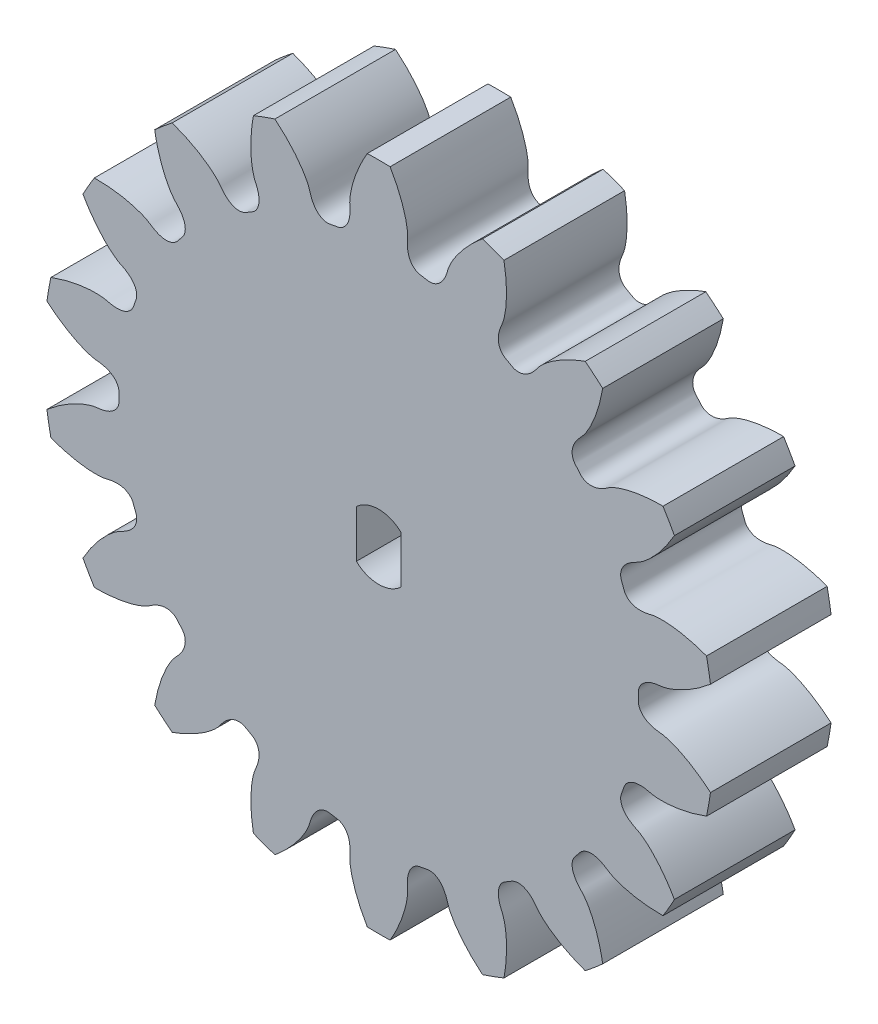
from build123d import *

# Parameters (mm, degrees)
SKETCH_311_W               = 10
SKETCH_311_H               = 27.777777778
CUT_EXTRUDE_550_DEPTH      = 9.525
PATTERN_CIRCULAR_604_COUNT = 18
CUT_EXTRUDE2_DEPTH         = 7.5


with BuildPart() as part:
    # Sketch 311 → Revolve 374 (revolve)
    with BuildSketch(Plane(origin=(0, 0, 0), x_dir=(0, 0, -1), z_dir=(1, 0, 0))):
        with Locations((0, 13.888888889)):
            Rectangle(SKETCH_311_W, SKETCH_311_H)
    revolve(axis=Axis((0, 0, 0), (0, 0, -1)))

    # Sketch 419 → Cut-Extrude 550 (cut, symmetric)
    with BuildSketch(Plane.XY):
        with BuildLine():
            ThreePointArc((27.62923006, 3.995738236), (27.916666667, 0), (27.62923006, -3.995738236))
            add(Edge.make_bspline(
                [(27.62923006, -3.995738236), (27.290831329, -3.702438459), (26.835049509, -3.341121703), (26.253328704, -2.941020847), (25.937510715, -2.738409328), (25.636143491, -2.558437255), (25.350333726, -2.399956765), (25.081128503, -2.261771509), (24.82951387, -2.142641125), (24.596412985, -2.041283545), (24.382684516, -1.956377728), (24.189121081, -1.886566916), (24.016447952, -1.830460144), (23.865321409, -1.786639488), (23.736328641, -1.753650229), (23.629983592, -1.730041219), (23.546734518, -1.714265852), (23.486941462, -1.704946935), (23.45092391, -1.700297747), (23.380025983, -1.693832885), (23.294978928, -1.687179277), (23.188735628, -1.674087341), (23.112132431, -1.663291598), (23.036959642, -1.651060808), (22.963188988, -1.637452508), (22.890796253, -1.62243551), (22.819752103, -1.605993678), (22.750024416, -1.588097373), (22.681577704, -1.568709322), (22.614373436, -1.547781188), (22.548370339, -1.525252273), (22.483524999, -1.501047302), (22.419792807, -1.475074072), (22.357129399, -1.44722073), (22.295492758, -1.417352757), (22.234846223, -1.385309698), (22.175162695, -1.350901748), (22.116430401, -1.313906457), (22.058660633, -1.274065928), (22.001897932, -1.231085154), (21.946233111, -1.184632474), (21.89181938, -1.134343527), (21.838891389, -1.079830578), (21.787786315, -1.02069952), (21.738964806, -0.956577061), (21.693028098, -0.887150157), (21.650724958, -0.812218363), (21.612942971, -0.731756292), (21.580668491, -0.645980549), (21.554941069, -0.555402644), (21.536683336, -0.460873936), (21.527650399, -0.371147884), (21.523754674, -0.217235259), (21.53096184, 0), (21.523754674, 0.217235259), (21.527650399, 0.371147884), (21.536683336, 0.460873936), (21.554941069, 0.555402644), (21.580668491, 0.645980549), (21.612942971, 0.731756292), (21.650724958, 0.812218363), (21.693028098, 0.887150157), (21.738964806, 0.956577061), (21.787786315, 1.02069952), (21.838891389, 1.079830578), (21.89181938, 1.134343527), (21.946233111, 1.184632474), (22.001897932, 1.231085154), (22.058660633, 1.274065928), (22.116430401, 1.313906457), (22.175162695, 1.350901748), (22.234846223, 1.385309698), (22.295492758, 1.417352757), (22.357129399, 1.44722073), (22.419792807, 1.475074072), (22.483524999, 1.501047302), (22.548370339, 1.525252273), (22.614373436, 1.547781188), (22.681577704, 1.568709322), (22.750024416, 1.588097373), (22.819752103, 1.605993678), (22.890796253, 1.62243551), (22.963188988, 1.637452508), (23.036959642, 1.651060808), (23.112132431, 1.663291598), (23.188735628, 1.674087341), (23.294978928, 1.687179277), (23.380025983, 1.693832885), (23.45092391, 1.700297747), (23.486941462, 1.704946935), (23.546734518, 1.714265852), (23.629983592, 1.730041219), (23.736328641, 1.753650229), (23.865321409, 1.786639488), (24.016447952, 1.830460144), (24.189121081, 1.886566916), (24.382684516, 1.956377728), (24.596412985, 2.041283545), (24.82951387, 2.142641125), (25.081128503, 2.261771509), (25.350333726, 2.399956765), (25.636143491, 2.558437255), (25.937510715, 2.738409328), (26.253328704, 2.941020847), (26.835049509, 3.341121703), (27.290831329, 3.702438459), (27.62923006, 3.995738236)],
                knots=[0, 0, 0, 0, 0.086681892, 0.112454454, 0.136665043, 0.159313658, 0.1804003, 0.199924969, 0.217887664, 0.234288386, 0.249127134, 0.262403909, 0.274118711, 0.284271539, 0.292862394, 0.299891276, 0.305358185, 0.30926312, 0.311606084, 0.312387082, 0.323045666, 0.328117752, 0.333108821, 0.33802219, 0.342861525, 0.34763088, 0.352334746, 0.356978107, 0.3615665, 0.366106083, 0.370603711, 0.375067019, 0.379504513, 0.383925662, 0.388341001, 0.39276222, 0.397202256, 0.401675347, 0.406197062, 0.410784251, 0.415454908, 0.420227881, 0.425122382, 0.430157244, 0.435349849, 0.44071472, 0.446261769, 0.451994334, 0.45790724, 0.46398525, 0.470202375, 0.476522482, 0.481418853, 0.5, 0.518581147, 0.523477518, 0.529797625, 0.53601475, 0.54209276, 0.548005666, 0.553738231, 0.55928528, 0.564650151, 0.569842756, 0.574877618, 0.579772119, 0.584545092, 0.589215749, 0.593802938, 0.598324653, 0.602797744, 0.60723778, 0.611658999, 0.616074338, 0.620495487, 0.624932981, 0.629396289, 0.633893917, 0.6384335, 0.643021893, 0.647665254, 0.65236912, 0.657138475, 0.66197781, 0.666891179, 0.671882248, 0.676954334, 0.687612918, 0.688393916, 0.69073688, 0.694641815, 0.700108724, 0.707137606, 0.715728461, 0.725881289, 0.737596091, 0.750872866, 0.765711614, 0.782112336, 0.800075031, 0.8195997, 0.840686342, 0.863334957, 0.887545546, 0.913318108, 1, 1, 1, 1], degree=3))
        make_face()
    cut_extrude_550 = extrude(amount=CUT_EXTRUDE_550_DEPTH, both=True, mode=Mode.SUBTRACT)

    # Pattern Circular 604: Cut-Extrude 550 ×18 about axis
    pattern_circular_604_axis = Axis((0, 0, 55), (0, 0, -1))
    for i in range(1, PATTERN_CIRCULAR_604_COUNT):
        add(cut_extrude_550.rotate(pattern_circular_604_axis, i * 360 / PATTERN_CIRCULAR_604_COUNT), mode=Mode.SUBTRACT)

    # Sketch5 → Cut-Extrude2 (cut)
    with BuildSketch(Plane.XY.offset(5)):
        with BuildLine():
            Line((-1.85, 1.966596044), (-1.85, -1.966596044))
            ThreePointArc((-1.85, -1.966596044), (0, -2.7), (1.85, -1.966596044))
            Line((1.85, -1.966596044), (1.85, 1.966596044))
            ThreePointArc((1.85, 1.966596044), (0, 2.7), (-1.85, 1.966596044))
        make_face()
    extrude(amount=-CUT_EXTRUDE2_DEPTH, mode=Mode.SUBTRACT)


solid = part.part
